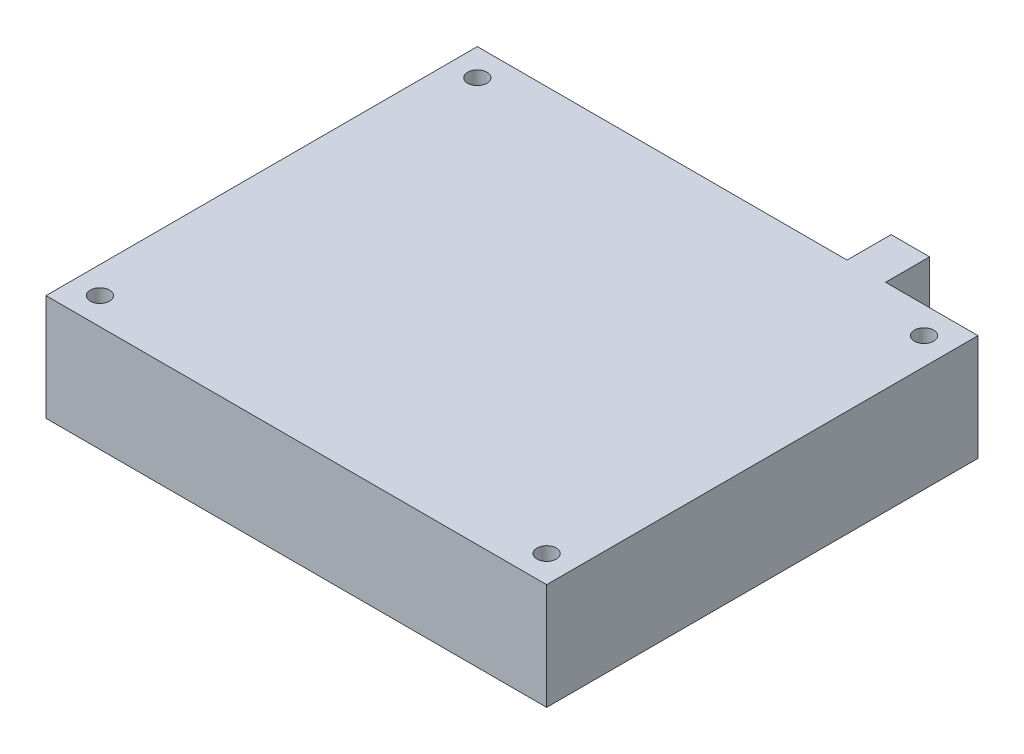
from build123d import *

# Parameters (mm, degrees)
SKETCH_1_W      = 65
SKETCH_1_H      = 56
SKETCH_1_R      = 1.25
EXTRUDE_1_DEPTH = 13.8
SKETCH_2_W      = 5
SKETCH_2_H      = 5.72
EXTRUDE_2_DEPTH = 13.8


with BuildPart() as part:
    # 草图1 → 凸台-拉伸1 (new body)
    with BuildSketch(Plane(origin=(0, 0, 0), x_dir=(1, 0, 0), z_dir=(0, 1, 0))):
        Rectangle(SKETCH_1_W, SKETCH_1_H)
        with Locations(Location((-29, 24.5, 0), (0, 0, 90))):
            Circle(SKETCH_1_R, mode=Mode.SUBTRACT)
        with Locations(Location((29, 24.5, 0), (0, 0, 90))):
            Circle(SKETCH_1_R, mode=Mode.SUBTRACT)
        with Locations(Location((29, -24.5, 0), (0, 0, 90))):
            Circle(SKETCH_1_R, mode=Mode.SUBTRACT)
        with Locations(Location((-29, -24.5, 0), (0, 0, 90))):
            Circle(SKETCH_1_R, mode=Mode.SUBTRACT)
    extrude(amount=EXTRUDE_1_DEPTH)

    # 草图2 → 凸台-拉伸2 (add)
    with BuildSketch(Plane(origin=(0, 13.8, 0), x_dir=(1, 0, 0), z_dir=(0, 1, 0))):
        with Locations((18, 30.86)):
            Rectangle(SKETCH_2_W, SKETCH_2_H)
    extrude(amount=-EXTRUDE_2_DEPTH)


solid = part.part
